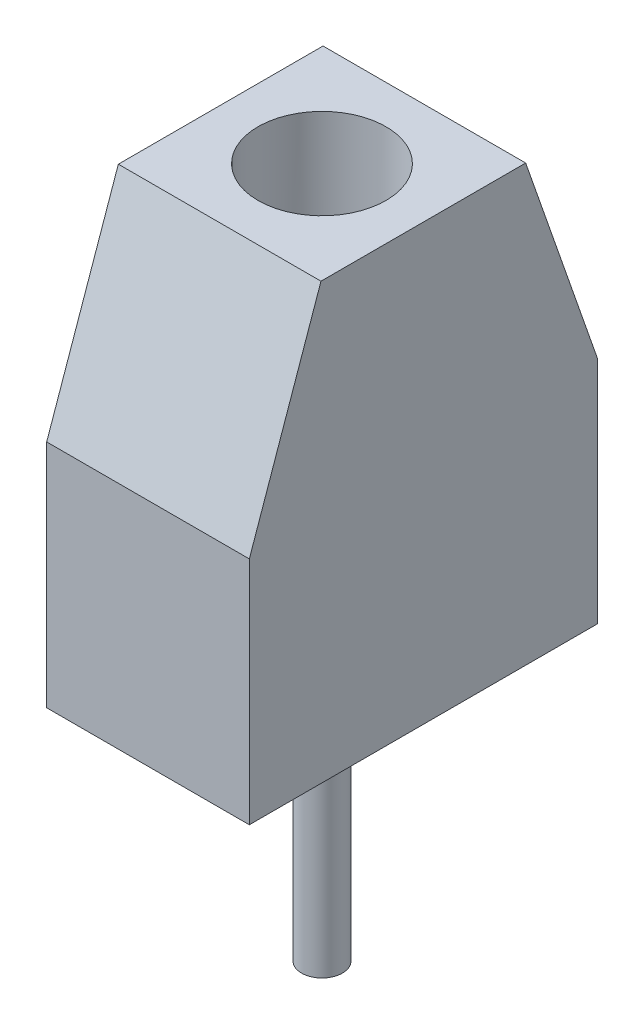
from build123d import *
from build123d.topology import SkipClean

# Parameters (mm, degrees)
EXTRUDE_1_DEPTH     = 3.96
SKETCH_3_R          = 1.25
CUT_EXTRUDE_1_DEPTH = 2
CUT_EXTRUDE_2_DEPTH = 0.5
SKETCH_5_R          = 0.4
EXTRUDE_2_DEPTH     = 5


with BuildPart() as part:
    # 草图1 → 凸台-拉伸1 (new body)
    with BuildSketch(Plane(origin=(0, 0, 0), x_dir=(0, 0, -1), z_dir=(1, 0, 0))):
        Polygon((3.4, 0), (-3.4, 0), (-3.4, 4.5), (-2, 8.5), (2, 8.5), (3.4, 4.5), align=None)
    extrude(amount=EXTRUDE_1_DEPTH)

    # 草图3 → 切除-拉伸1 (cut)
    with BuildSketch(Plane(origin=(0, 8.5, 0), x_dir=(1, 0, 0), z_dir=(0, 1, 0))):
        with Locations(Location((1.98, 0, 0), (0, 0, 270))):
            Circle(SKETCH_3_R)
    extrude(amount=-CUT_EXTRUDE_1_DEPTH, mode=Mode.SUBTRACT)

    # 草图4 → 切除-拉伸2 (cut)
    with SkipClean():  # the faces are left unmerged after this step: merging them gives an invalid solid
        with BuildSketch(Plane(origin=(0, 6.5, 0), x_dir=(1, 0, 0), z_dir=(0, 1, 0))):
            with BuildLine():
                Line((0.755255129, 0.25), (3.204744871, 0.25))
                ThreePointArc((3.204744871, 0.25), (3.23, 0), (3.204744871, -0.25))
                Line((3.204744871, -0.25), (0.755255129, -0.25))
                ThreePointArc((0.755255129, -0.25), (0.73, 0), (0.755255129, 0.25))
            make_face()
        extrude(amount=-CUT_EXTRUDE_2_DEPTH, mode=Mode.SUBTRACT)

    # 草图5 → 凸台-拉伸2 (add)
    with SkipClean():  # the faces are left unmerged after this step: merging them gives an invalid solid
        with BuildSketch(Plane.XZ):
            with Locations(Location((1.98, 0, 0), (0, 0, 90))):
                Circle(SKETCH_5_R)
        extrude(amount=EXTRUDE_2_DEPTH)


solid = part.part
